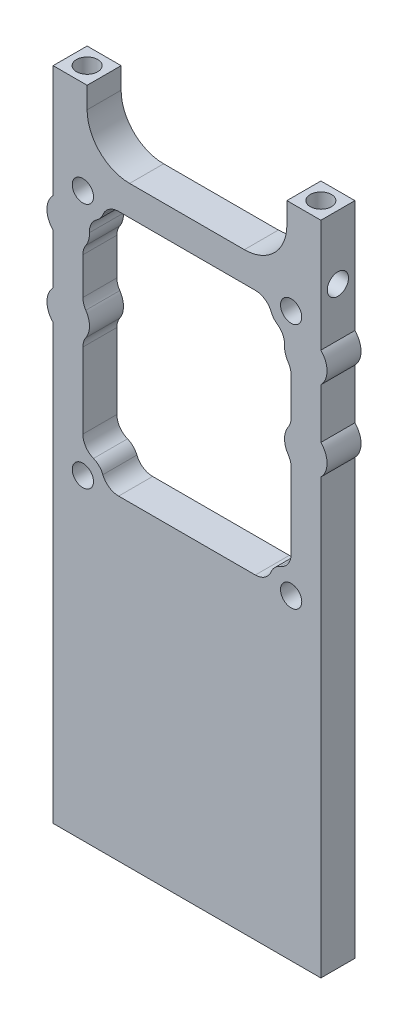
from build123d import *

# Parameters (mm, degrees)
EXTRUDE_1_DEPTH     = 8
SKETCH_2_R          = 2.5
CUT_EXTRUDE_1_DEPTH = 6
SKETCH_3_R          = 2.5
CUT_EXTRUDE_2_DEPTH = 6
FILLET_1_R          = 10
SKETCH_4_W          = 39
SKETCH_4_H          = 48
SKETCH_4_W_2        = 5
SKETCH_4_H_2        = 5
CUT_EXTRUDE_3_DEPTH = 21
SKETCH_5_R          = 5
EXTRUDE_2_DEPTH     = 8
FILLET_2_R          = 4
FILLET_3_R          = 4
SKETCH_6_R          = 2.5
CUT_EXTRUDE_4_DEPTH = 6
SKETCH_7_R          = 2.5
CUT_EXTRUDE_5_DEPTH = 6


with BuildPart() as part:
    # Эскиз1 → Бобышка-Вытянуть1 (new body)
    with BuildSketch(Plane.XY):
        Polygon((-23.5, 62.203361065), (-23.5, 77.203361065), (-31.5, 77.203361065), (-31.5, -77.203361065), (31.5, -77.203361065), (31.5, 77.203361065), (23.5, 77.203361065), (23.5, 62.203361065), align=None)
    extrude(amount=EXTRUDE_1_DEPTH)

    # Эскиз2 → Вырез-Вытянуть1 (cut)
    with BuildSketch(Plane(origin=(0, 77.203361065, 0), x_dir=(1, 0, 0), z_dir=(0, 1, 0))):
        with Locations(Location((-27.5, -4, 0), (0, 0, 180))):
            Circle(SKETCH_2_R)
        with Locations((27.5, -4)):
            Circle(SKETCH_2_R)
    extrude(amount=-CUT_EXTRUDE_1_DEPTH, mode=Mode.SUBTRACT)

    # Эскиз3 → Вырез-Вытянуть2 (cut)
    with BuildSketch(Plane.XY.offset(8)):
        with Locations((-24.5, 55.203361065)):
            Circle(SKETCH_3_R)
        with Locations((24.5, 55.203361065)):
            Circle(SKETCH_3_R)
        with Locations((24.5, -2.796638935)):
            Circle(SKETCH_3_R)
        with Locations((-24.5, -2.796638935)):
            Circle(SKETCH_3_R)
    extrude(amount=-CUT_EXTRUDE_2_DEPTH, mode=Mode.SUBTRACT)

    # Скругление1
    fillet_1_edges = [part.edges().sort_by_distance(p)[0] for p in [
        (-23.5, 62.203361065, 4),
        (23.5, 62.203361065, 4),
    ]]
    fillet(fillet_1_edges, radius=FILLET_1_R)

    # Эскиз4 → Вырез-Вытянуть3 (cut)
    with BuildSketch(Plane.XY.offset(8)):
        with Locations((0, 26.203361065)):
            Rectangle(SKETCH_4_W, SKETCH_4_H)
        with Locations((-22, 26.203361065)):
            Rectangle(SKETCH_4_W_2, SKETCH_4_H)
        with Locations((0, 52.703361065)):
            Rectangle(SKETCH_4_W, SKETCH_4_H_2)
        with Locations((22, 26.203361065)):
            Rectangle(SKETCH_4_W_2, SKETCH_4_H)
        with Locations((0, -0.296638935)):
            Rectangle(SKETCH_4_W, SKETCH_4_H_2)
    extrude(amount=-CUT_EXTRUDE_3_DEPTH, mode=Mode.SUBTRACT)

    # Эскиз5 → Бобышка-Вытянуть2 (add)
    with BuildSketch(Plane(origin=(0, 0, 0), x_dir=(-1, 0, 0), z_dir=(0, 0, -1))):
        with Locations((-27.95, 47.203361065)):
            Circle(SKETCH_5_R)
        with Locations((-27.95, 28.403361065)):
            Circle(SKETCH_5_R)
        with Locations((27.95, 28.403361065)):
            Circle(SKETCH_5_R)
        with Locations((27.95, 47.203361065)):
            Circle(SKETCH_5_R)
    extrude(amount=-EXTRUDE_2_DEPTH)

    # Скругление2
    fillet_2_edges = [part.edges().sort_by_distance(p)[0] for p in [
        (-19.5, 2.203361065, 4),
        (-19.5, 50.203361065, 4),
        (19.5, 50.203361065, 4),
        (19.5, 2.203361065, 4),
    ]]
    fillet(fillet_2_edges, radius=FILLET_2_R)

    # Скругление3
    fillet_3_edges = [part.edges().sort_by_distance(p)[0] for p in [
        (-24.5, 32.0224079, 4),
        (-24.5, 24.784314229, 4),
        (-24.5, 43.584314229, 4),
        (-23.95, 50.203361065, 4),
        (-19.5, 55.203361065, 4),
        (24.5, 32.0224079, 4),
        (24.5, 24.784314229, 4),
        (24.5, 43.584314229, 4),
        (19.5, 55.203361065, 4),
        (23.95, 50.203361065, 4),
        (24.5, 2.203361065, 4),
        (19.5, -2.796638935, 4),
        (-19.5, -2.796638935, 4),
        (-24.5, 2.203361065, 4),
    ]]
    fillet(fillet_3_edges, radius=FILLET_3_R)

    # Эскиз6 → Вырез-Вытянуть4 (cut)
    with BuildSketch(Plane(origin=(0, 0, 0), x_dir=(-1, 0, 0), z_dir=(0, 0, -1))):
        with Locations((-27.95, 47.203361065)):
            Circle(SKETCH_6_R)
        with Locations((27.95, 47.203361065)):
            Circle(SKETCH_6_R)
        with Locations((27.95, 28.403361065)):
            Circle(SKETCH_6_R)
        with Locations((-27.95, 28.403361065)):
            Circle(SKETCH_6_R)
    extrude(amount=-CUT_EXTRUDE_4_DEPTH, mode=Mode.SUBTRACT)

    # Эскиз7 → Вырез-Вытянуть5 (cut)
    with BuildSketch(Plane.ZY.offset(31.5)):
        with Locations((4, 62.203361065)):
            Circle(SKETCH_7_R)
    cut_extrude_5 = extrude(amount=-CUT_EXTRUDE_5_DEPTH, mode=Mode.SUBTRACT)

    # Зеркальное отражение1: Вырез-Вытянуть5 across plane
    add(cut_extrude_5.mirror(Plane(origin=(0, 0, 0), x_dir=(0, 0, 1), z_dir=(1, 0, 0))), mode=Mode.SUBTRACT)


solid = part.part
